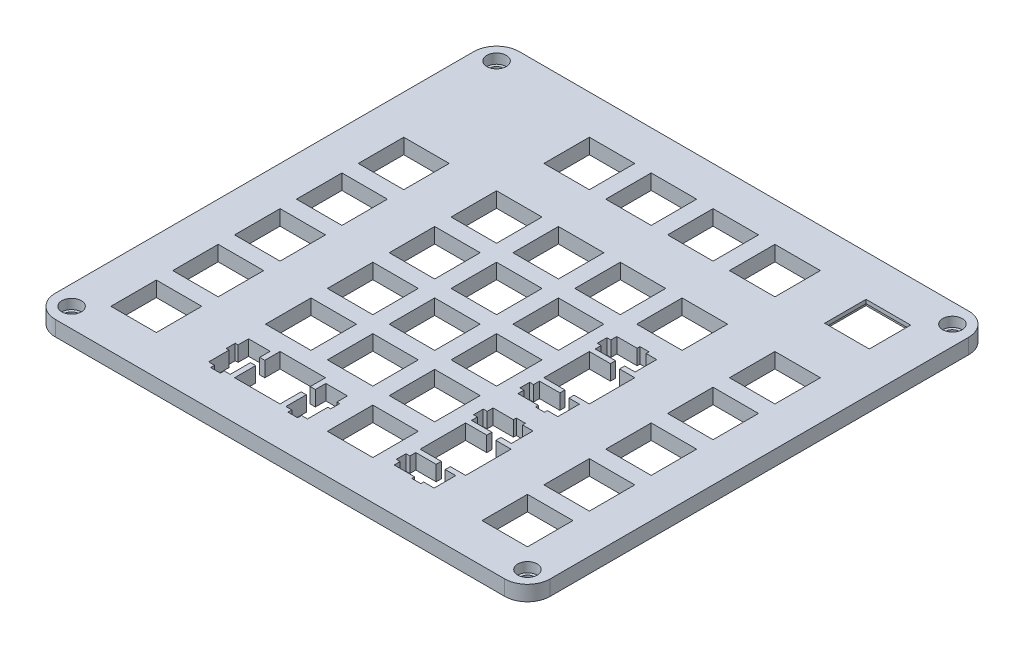
from build123d import *

# Parameters (mm, degrees)
SKETCH6_R               = 2
SKETCH6_R_2             = 2.15
SKETCH6_W               = 14
SKETCH6_H               = 14
BOSS_EXTRUDE1_DEPTH     = 4.68
CUT_EXTRUDE1_DEPTH      = 209.941263038
CUT_EXTRUDE1_DEPTH_BACK = 209.941263038
SKETCH15_W              = 13.75
SKETCH15_H              = 12.75
CUT_EXTRUDE2_DEPTH      = 2
SKETCH17_R              = 3
CUT_EXTRUDE3_DEPTH      = 3
SKETCH19_W              = 19.75
SKETCH19_H              = 18.75
CUT_EXTRUDE5_DEPTH      = 3.5
SKETCH18_W              = 12.14
SKETCH18_H              = 8.43
CUT_EXTRUDE4_DEPTH      = 2


with BuildPart() as part:
    # Sketch6 → Boss-Extrude1 (new body)
    with BuildSketch(Plane(origin=(0, 0, 0), x_dir=(1, 0, 0), z_dir=(0, 1, 0))):
        with BuildLine():
            Line((7, 0), (145.39, 0))
            ThreePointArc((145.39, 0), (150.339747468, 2.050252532), (152.39, 7))
            Line((152.39, 7), (152.39, 135.87))
            ThreePointArc((152.39, 135.87), (150.339747468, 140.819747468), (145.39, 142.87))
            Line((145.39, 142.87), (7, 142.87))
            ThreePointArc((7, 142.87), (2.050252532, 140.819747468), (0, 135.87))
            Line((0, 135.87), (0, 7))
            ThreePointArc((0, 7), (2.050252532, 2.050252532), (7, 0))
        make_face()
        with Locations(Location((133.34, 123.82, 0), (0, 0, 90))):
            Circle(SKETCH6_R, mode=Mode.SUBTRACT)
        with Locations(Location((5.995, 136.875, 0), (0, 0, 90))):
            Circle(SKETCH6_R_2, mode=Mode.SUBTRACT)
        with Locations(Location((146.395, 136.875, 0), (0, 0, 90))):
            Circle(SKETCH6_R_2, mode=Mode.SUBTRACT)
        with Locations(Location((146.395, 5.995, 0), (0, 0, 90))):
            Circle(SKETCH6_R_2, mode=Mode.SUBTRACT)
        with Locations(Location((5.995, 5.995, 0), (0, 0, 90))):
            Circle(SKETCH6_R_2, mode=Mode.SUBTRACT)
        with Locations((47.62, 123.825)):
            Rectangle(SKETCH6_W, SKETCH6_H, mode=Mode.SUBTRACT)
        with Locations((66.67, 123.825)):
            Rectangle(SKETCH6_W, SKETCH6_H, mode=Mode.SUBTRACT)
        with Locations((85.72, 123.825)):
            Rectangle(SKETCH6_W, SKETCH6_H, mode=Mode.SUBTRACT)
        with Locations((104.77, 123.825)):
            Rectangle(SKETCH6_W, SKETCH6_H, mode=Mode.SUBTRACT)
        with Locations((19.045, 95.25)):
            Rectangle(SKETCH6_W, SKETCH6_H, mode=Mode.SUBTRACT)
        with Locations((47.62, 95.25)):
            Rectangle(SKETCH6_W, SKETCH6_H, mode=Mode.SUBTRACT)
        with Locations((66.67, 95.25)):
            Rectangle(SKETCH6_W, SKETCH6_H, mode=Mode.SUBTRACT)
        with Locations((85.72, 95.25)):
            Rectangle(SKETCH6_W, SKETCH6_H, mode=Mode.SUBTRACT)
        with Locations((104.77, 95.25)):
            Rectangle(SKETCH6_W, SKETCH6_H, mode=Mode.SUBTRACT)
        with Locations((133.345, 95.25)):
            Rectangle(SKETCH6_W, SKETCH6_H, mode=Mode.SUBTRACT)
        with Locations((19.045, 76.2)):
            Rectangle(SKETCH6_W, SKETCH6_H, mode=Mode.SUBTRACT)
        with Locations((47.62, 76.2)):
            Rectangle(SKETCH6_W, SKETCH6_H, mode=Mode.SUBTRACT)
        with Locations((66.67, 76.2)):
            Rectangle(SKETCH6_W, SKETCH6_H, mode=Mode.SUBTRACT)
        with Locations((85.72, 76.2)):
            Rectangle(SKETCH6_W, SKETCH6_H, mode=Mode.SUBTRACT)
        Polygon((98, 77.075), (98, 75.25), (104.27, 75.25), (104.27, 73.675), (97.77, 73.675), (97.77, 59.675), (104.27, 59.675), (104.27, 58.1), (98, 58.1), (98, 56.275), (96.8, 56.275), (96.8, 53.275), (98, 53.275), (98, 51.45), (104.27, 51.45), (104.27, 50.575), (107.07, 50.575), (107.07, 51.45), (110.3, 51.45), (110.3, 58.1), (107.07, 58.1), (107.07, 59.675), (111.77, 59.675), (111.77, 73.675), (107.07, 73.675), (107.07, 75.25), (110.3, 75.25), (110.3, 81.9), (107.07, 81.9), (107.07, 82.775), (104.27, 82.775), (104.27, 81.9), (98, 81.9), (98, 80.075), (96.8, 80.075), (96.8, 77.075), align=None, mode=Mode.SUBTRACT)
        with Locations((133.345, 76.2)):
            Rectangle(SKETCH6_W, SKETCH6_H, mode=Mode.SUBTRACT)
        with Locations((19.045, 57.15)):
            Rectangle(SKETCH6_W, SKETCH6_H, mode=Mode.SUBTRACT)
        with Locations((47.62, 57.15)):
            Rectangle(SKETCH6_W, SKETCH6_H, mode=Mode.SUBTRACT)
        with Locations((66.67, 57.15)):
            Rectangle(SKETCH6_W, SKETCH6_H, mode=Mode.SUBTRACT)
        with Locations((85.72, 57.15)):
            Rectangle(SKETCH6_W, SKETCH6_H, mode=Mode.SUBTRACT)
        with Locations((133.345, 57.15)):
            Rectangle(SKETCH6_W, SKETCH6_H, mode=Mode.SUBTRACT)
        with Locations((19.045, 38.1)):
            Rectangle(SKETCH6_W, SKETCH6_H, mode=Mode.SUBTRACT)
        with Locations((47.62, 38.1)):
            Rectangle(SKETCH6_W, SKETCH6_H, mode=Mode.SUBTRACT)
        with Locations((66.67, 38.1)):
            Rectangle(SKETCH6_W, SKETCH6_H, mode=Mode.SUBTRACT)
        with Locations((85.72, 38.1)):
            Rectangle(SKETCH6_W, SKETCH6_H, mode=Mode.SUBTRACT)
        Polygon((98, 38.975), (98, 37.15), (104.27, 37.15), (104.27, 35.575), (97.77, 35.575), (97.77, 21.575), (104.27, 21.575), (104.27, 20), (98, 20), (98, 18.175), (96.8, 18.175), (96.8, 15.175), (98, 15.175), (98, 13.35), (104.27, 13.35), (104.27, 12.475), (107.07, 12.475), (107.07, 13.35), (110.3, 13.35), (110.3, 20), (107.07, 20), (107.07, 21.575), (111.77, 21.575), (111.77, 35.575), (107.07, 35.575), (107.07, 37.15), (110.3, 37.15), (110.3, 43.8), (107.07, 43.8), (107.07, 44.675), (104.27, 44.675), (104.27, 43.8), (98, 43.8), (98, 41.975), (96.8, 41.975), (96.8, 38.975), align=None, mode=Mode.SUBTRACT)
        with Locations((133.345, 38.1)):
            Rectangle(SKETCH6_W, SKETCH6_H, mode=Mode.SUBTRACT)
        with Locations((19.045, 19.05)):
            Rectangle(SKETCH6_W, SKETCH6_H, mode=Mode.SUBTRACT)
        Polygon((46.745, 12.28), (48.57, 12.28), (48.57, 18.55), (50.145, 18.55), (50.145, 12.05), (64.145, 12.05), (64.145, 18.55), (65.72, 18.55), (65.72, 12.28), (67.545, 12.28), (67.545, 11.08), (70.545, 11.08), (70.545, 12.28), (72.37, 12.28), (72.37, 18.55), (73.245, 18.55), (73.245, 21.35), (72.37, 21.35), (72.37, 24.58), (65.72, 24.58), (65.72, 21.35), (64.145, 21.35), (64.145, 26.05), (50.145, 26.05), (50.145, 21.35), (48.57, 21.35), (48.57, 24.58), (41.92, 24.58), (41.92, 21.35), (41.045, 21.35), (41.045, 18.55), (41.92, 18.55), (41.92, 12.28), (43.745, 12.28), (43.745, 11.08), (46.745, 11.08), align=None, mode=Mode.SUBTRACT)
        with Locations((85.72, 19.05)):
            Rectangle(SKETCH6_W, SKETCH6_H, mode=Mode.SUBTRACT)
        with Locations((133.345, 19.05)):
            Rectangle(SKETCH6_W, SKETCH6_H, mode=Mode.SUBTRACT)
    extrude(amount=BOSS_EXTRUDE1_DEPTH)

    # Sketch15 → Cut-Extrude1 (cut, two sides: drawn at the far end of the back side and taken through both)
    with BuildSketch(Plane(origin=(0, 4.68, 0), x_dir=(1, 0, 0), z_dir=(0, 1, 0)).offset(-CUT_EXTRUDE1_DEPTH_BACK)):
        with Locations((133.34, 123.82)):
            Rectangle(SKETCH15_W, SKETCH15_H)
    extrude(amount=CUT_EXTRUDE1_DEPTH + CUT_EXTRUDE1_DEPTH_BACK, mode=Mode.SUBTRACT)

    # Sketch16 → Cut-Extrude2 (cut)
    with BuildSketch(Plane.XZ):
        with BuildLine():
            Line((17.9, -119.58), (17.9, -123.58))
            ThreePointArc((17.9, -123.58), (11.45, -130.03), (5, -123.58))
            Line((5, -123.58), (5, -119.58))
            ThreePointArc((5, -119.58), (11.45, -113.13), (17.9, -119.58))
        make_face()
    extrude(amount=-CUT_EXTRUDE2_DEPTH, mode=Mode.SUBTRACT)

    # Sketch17 → Cut-Extrude3 (cut)
    with BuildSketch(Plane(origin=(0, 4.68, 0), x_dir=(1, 0, 0), z_dir=(0, 1, 0))):
        with Locations(Location((5.995, 5.995, 0), (0, 0, 270))):
            Circle(SKETCH17_R)
        with Locations(Location((146.395, 5.995, 0), (0, 0, 270))):
            Circle(SKETCH17_R)
        with Locations(Location((146.395, 136.875, 0), (0, 0, 270))):
            Circle(SKETCH17_R)
        with Locations(Location((5.995, 136.875, 0), (0, 0, 270))):
            Circle(SKETCH17_R)
    extrude(amount=-CUT_EXTRUDE3_DEPTH, mode=Mode.SUBTRACT)

    # Sketch19 → Cut-Extrude5 (cut)
    with BuildSketch(Plane.XZ):
        with Locations((133.34, -123.82)):
            Rectangle(SKETCH19_W, SKETCH19_H)
    extrude(amount=-CUT_EXTRUDE5_DEPTH, mode=Mode.SUBTRACT)

    # Sketch18 → Cut-Extrude4 (cut)
    with BuildSketch(Plane.XZ):
        with Locations((34.42, -138.655)):
            Rectangle(SKETCH18_W, SKETCH18_H)
    extrude(amount=-CUT_EXTRUDE4_DEPTH, mode=Mode.SUBTRACT)


solid = part.part
